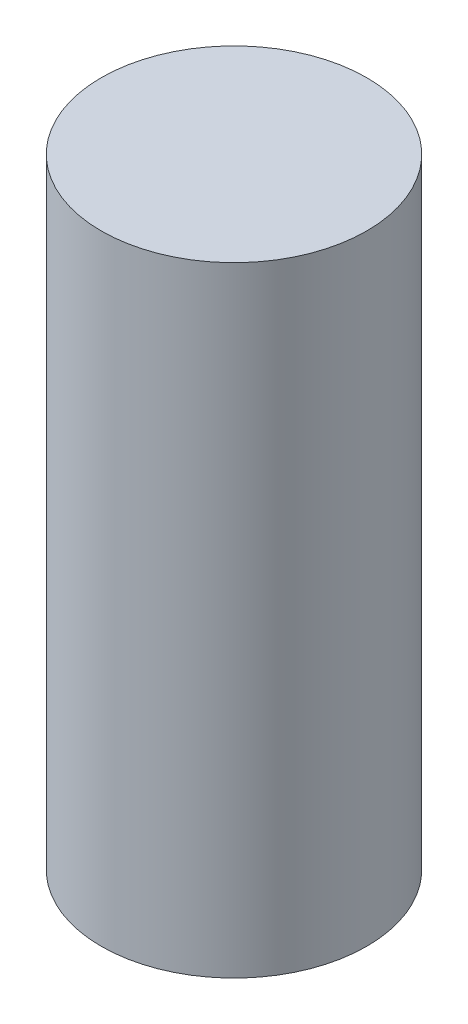
from build123d import *

# Parameters (mm, degrees)
SKETCH_1_R      = 1.5
EXTRUDE_1_DEPTH = 7


with BuildPart() as part:
    # 草图1 → 凸台-拉伸1 (new body)
    with BuildSketch(Plane(origin=(0, 0, 0), x_dir=(1, 0, 0), z_dir=(0, 1, 0))):
        with Locations(Location((0, 0, 0), (0, 0, 270))):
            Circle(SKETCH_1_R)
    extrude(amount=EXTRUDE_1_DEPTH)


solid = part.part
